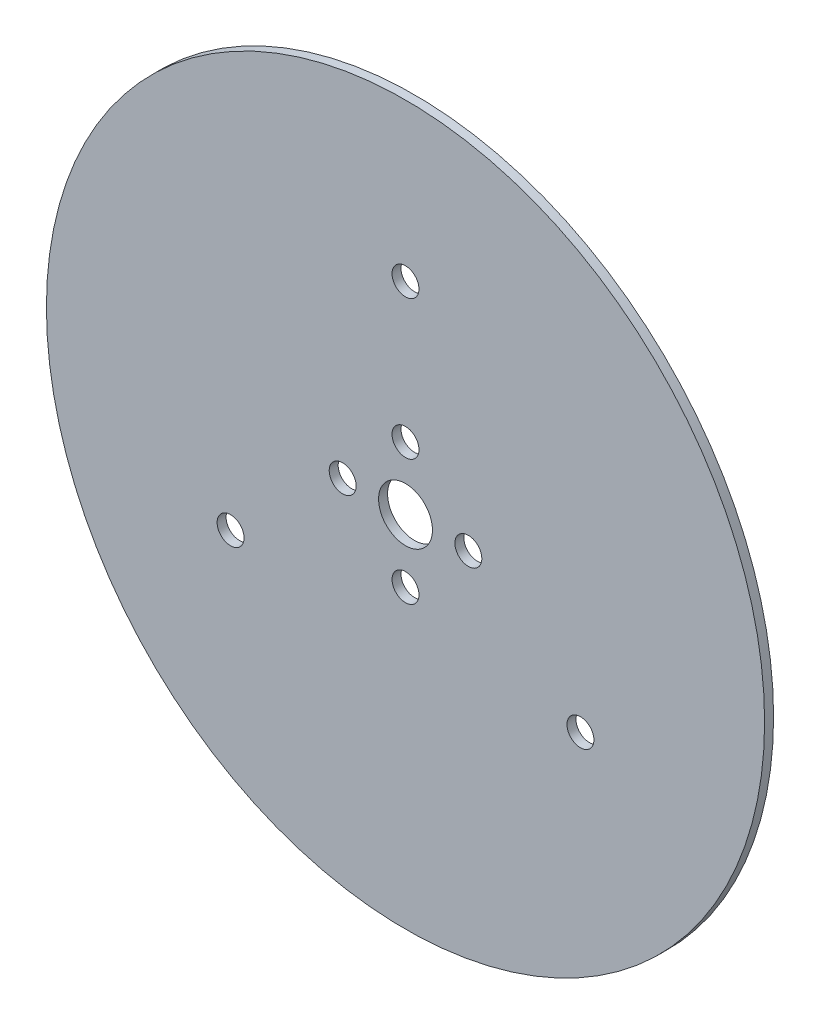
from build123d import *

# Parameters (mm, degrees)
SKETCH_1_R          = 40
SKETCH_1_R_2        = 2.5
SKETCH_1_R_3        = 1.5
EXTRUDE_1_DEPTH     = 1
SKETCH_2_R          = 1.5
CUT_EXTRUDE_1_DEPTH = 10
SKETCH_3_R          = 3
CUT_EXTRUDE_2_DEPTH = 10


with BuildPart() as part:
    # 草图1 → 凸台-拉伸1 (new body)
    with BuildSketch(Plane.XY):
        Circle(SKETCH_1_R)
        Circle(SKETCH_1_R_2, mode=Mode.SUBTRACT)
        with Locations((0, 7)):
            Circle(SKETCH_1_R_3, mode=Mode.SUBTRACT)
        with Locations((7, 0)):
            Circle(SKETCH_1_R_3, mode=Mode.SUBTRACT)
        with Locations((0, -7)):
            Circle(SKETCH_1_R_3, mode=Mode.SUBTRACT)
        with Locations((-7, 0)):
            Circle(SKETCH_1_R_3, mode=Mode.SUBTRACT)
    extrude(amount=EXTRUDE_1_DEPTH)

    # 草图2 → 切除-拉伸1 (cut)
    with BuildSketch(Plane.XY.offset(1)):
        with Locations((0, 22.5)):
            Circle(SKETCH_2_R)
        with Locations((19.485571585, -11.25)):
            Circle(SKETCH_2_R)
        with Locations((-19.485571585, -11.25)):
            Circle(SKETCH_2_R)
    extrude(amount=-CUT_EXTRUDE_1_DEPTH, mode=Mode.SUBTRACT)

    # 草图3 → 切除-拉伸2 (cut)
    with BuildSketch(Plane.XY.offset(1)):
        Circle(SKETCH_3_R)
    extrude(amount=-CUT_EXTRUDE_2_DEPTH, mode=Mode.SUBTRACT)


solid = part.part
